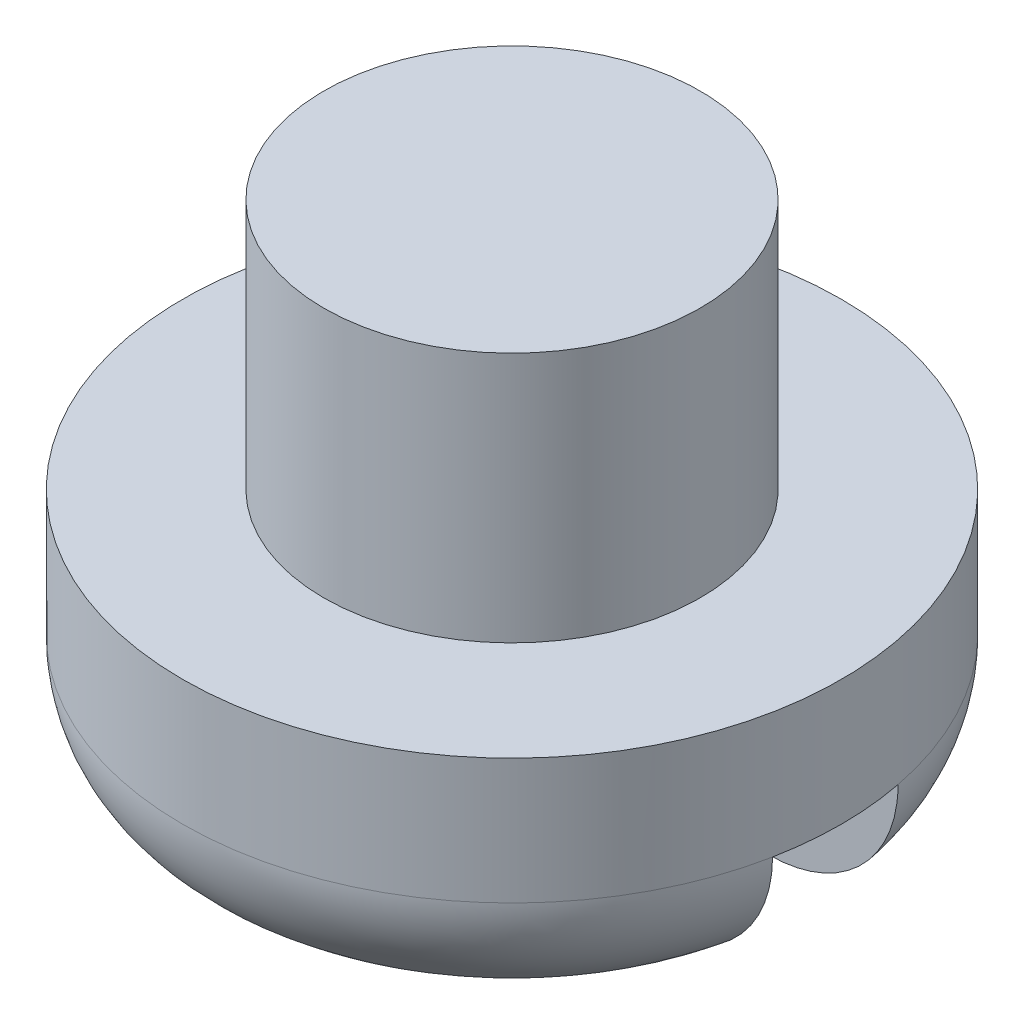
from build123d import *

# Parameters (mm, degrees)
SKETCH_1_R          = 1.5
EXTRUDE_1_DEPTH     = 2
SKETCH_2_R          = 2.625
EXTRUDE_2_DEPTH     = 2
FILLET_1_R          = 1
SKETCH_3_W          = 7.004697232
SKETCH_3_H          = 1
CUT_EXTRUDE_1_DEPTH = 1
SKETCH_4_W          = 1
SKETCH_4_H          = 3.75
CUT_EXTRUDE_2_DEPTH = 1


with BuildPart() as part:
    # 草图1 → 拉伸1 (new body)
    with BuildSketch(Plane(origin=(0, 0, 0), x_dir=(1, 0, 0), z_dir=(0, 1, 0))):
        Circle(SKETCH_1_R)
    extrude(amount=EXTRUDE_1_DEPTH)

    # 草图2 → Extrude 2 (add)
    with BuildSketch(Plane(origin=(0, 0, 0), x_dir=(-1, 0, 0), z_dir=(0, 1, 0))):
        Circle(SKETCH_2_R)
    extrude(amount=-EXTRUDE_2_DEPTH)

    # 圆角1
    fillet_1_edges = [part.edges().sort_by_distance(p)[0] for p in [
        (2.625, -2, 0),
    ]]
    fillet(fillet_1_edges, radius=FILLET_1_R)

    # 草图3 → 切除-拉伸1 (cut)
    with BuildSketch(Plane.XZ.offset(2)):
        Rectangle(SKETCH_3_W, SKETCH_3_H)
    extrude(amount=-CUT_EXTRUDE_1_DEPTH, mode=Mode.SUBTRACT)

    # 草图4 → 切除-拉伸2 (cut)
    with BuildSketch(Plane.XZ.offset(2)):
        Rectangle(SKETCH_4_W, SKETCH_4_H)
    extrude(amount=-CUT_EXTRUDE_2_DEPTH, mode=Mode.SUBTRACT)


solid = part.part
